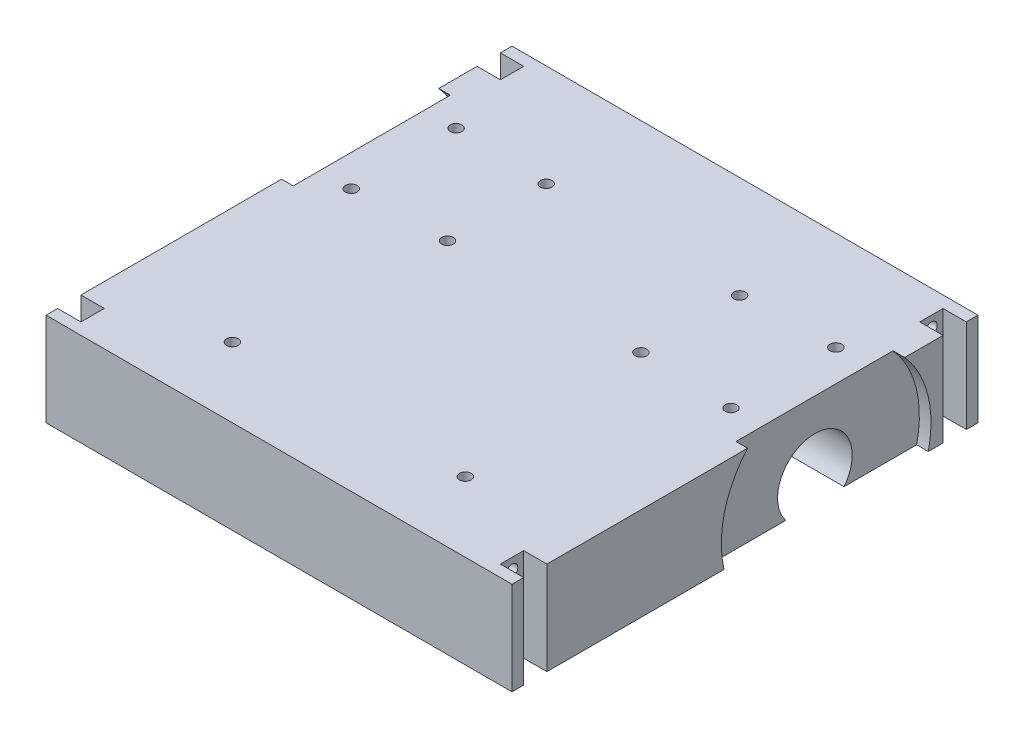
from build123d import *

# Parameters (mm, degrees)
ESQUISSE2_W             = 200
ESQUISSE2_H             = 200
BASE_DEPTH              = 40
ESQUISSE3_R             = 15
BLOC_MOTEUR_1_DEPTH     = 80
ESQUISSE4_W             = 10
ESQUISSE4_H             = 22.360679774
ACCES_MOTEUR_DEPTH      = 37
ESQUISSE6_R             = 16.01
BLOC_MOTEUR_2_DEPTH     = 37
ESQUISSE7_R             = 2.5
VIS_MOTEUR_DEPTH        = 147.969384567
ESQUISSE8_R             = 45
VIDE_ROUE_DEPTH         = 5
ESQUISSE9_W             = 10
ESQUISSE9_H             = 40
VIDE_GUIDAGE_TIGE_DEPTH = 10
ESQUISSE10_R            = 2.5
TROU_VIS_DEPTH          = 100
ESQUISSE11_R            = 2.5
VIDE_PATIN_DEPTH        = 147.969384567


with BuildPart() as part:
    # Esquisse2 → BASE (new body)
    with BuildSketch(Plane(origin=(0, 0, 0), x_dir=(1, 0, 0), z_dir=(0, 1, 0))):
        Rectangle(ESQUISSE2_W, ESQUISSE2_H)
    extrude(amount=BASE_DEPTH)

    # Esquisse3 → BLOC MOTEUR 1. (cut)
    with BuildSketch(Plane(origin=(100, 0, 0), x_dir=(0, 0, -1), z_dir=(1, 0, 0))):
        with Locations((35, 10)):
            Circle(ESQUISSE3_R)
    bloc_moteur_1 = extrude(amount=-BLOC_MOTEUR_1_DEPTH, mode=Mode.SUBTRACT)

    # Esquisse4 → ACCES MOTEUR (cut)
    with BuildSketch(Plane.XZ):
        with Locations((25, -35)):
            Rectangle(ESQUISSE4_W, ESQUISSE4_H)
    acces_moteur = extrude(amount=-ACCES_MOTEUR_DEPTH, mode=Mode.SUBTRACT)

    # Esquisse6 → BLOC MOTEUR 2 (cut)
    with BuildSketch(Plane(origin=(100, 0, 0), x_dir=(0, 0, -1), z_dir=(1, 0, 0))):
        with Locations((35, 10)):
            Circle(ESQUISSE6_R)
    bloc_moteur_2 = extrude(amount=-BLOC_MOTEUR_2_DEPTH, mode=Mode.SUBTRACT)

    # SYM BLOC MOTEUR: BLOC MOTEUR 1., ACCES MOTEUR, BLOC MOTEUR 2 across plane
    add(bloc_moteur_1.mirror(Plane(origin=(0, 0, 0), x_dir=(0, 0, 1), z_dir=(1, 0, 0))), mode=Mode.SUBTRACT)
    add(acces_moteur.mirror(Plane(origin=(0, 0, 0), x_dir=(0, 0, 1), z_dir=(1, 0, 0))), mode=Mode.SUBTRACT)
    add(bloc_moteur_2.mirror(Plane(origin=(0, 0, 0), x_dir=(0, 0, 1), z_dir=(1, 0, 0))), mode=Mode.SUBTRACT)

    # Esquisse7 → VIS MOTEUR (cut, through all)
    with BuildSketch(Plane.XZ):
        with Locations(Location((-81.5, -12.497196314, 0), (0, 0, 270))):
            Circle(ESQUISSE7_R)
        with Locations(Location((-41.5, -13.819660113, 0), (0, 0, 270))):
            Circle(ESQUISSE7_R)
        with Locations(Location((-41.5, -56.180339887, 0), (0, 0, 270))):
            Circle(ESQUISSE7_R)
        with Locations(Location((-81.5, -57.502803686, 0), (0, 0, 270))):
            Circle(ESQUISSE7_R)
    vis_moteur = extrude(amount=-VIS_MOTEUR_DEPTH, mode=Mode.SUBTRACT)

    # SYM VIS: VIS MOTEUR across plane
    add(vis_moteur.mirror(Plane(origin=(0, 0, 0), x_dir=(0, 0, 1), z_dir=(1, 0, 0))), mode=Mode.SUBTRACT)

    # Esquisse8 → VIDE ROUE (cut)
    with BuildSketch(Plane(origin=(100, 0, 0), x_dir=(0, 0, -1), z_dir=(1, 0, 0))):
        with Locations((34.831239624, 10.203988641)):
            Circle(ESQUISSE8_R)
    vide_roue = extrude(amount=-VIDE_ROUE_DEPTH, mode=Mode.SUBTRACT)

    # Esquisse9 → VIDE GUIDAGE TIGE (cut)
    with BuildSketch(Plane(origin=(100, 0, 0), x_dir=(0, 0, -1), z_dir=(1, 0, 0))):
        with Locations((90, 20)):
            Rectangle(ESQUISSE9_W, ESQUISSE9_H)
        with Locations((-90, 20)):
            Rectangle(ESQUISSE9_W, ESQUISSE9_H)
    vide_guidage_tige = extrude(amount=-VIDE_GUIDAGE_TIGE_DEPTH, mode=Mode.SUBTRACT)

    # Esquisse10 → TROU VIS (cut)
    with BuildSketch(Plane(origin=(90, 0, 0), x_dir=(0, 0, -1), z_dir=(1, 0, 0))):
        with Locations((-90, 35)):
            Circle(ESQUISSE10_R)
        with Locations((-90, 25)):
            Circle(ESQUISSE10_R)
        with Locations(Location((90, 25, 0), (0, 0, 180))):
            Circle(ESQUISSE10_R)
        with Locations(Location((90, 35, 0), (0, 0, 180))):
            Circle(ESQUISSE10_R)
        with Locations((-90, 15)):
            Circle(ESQUISSE10_R)
        with Locations(Location((90, 15, 0), (0, 0, 180))):
            Circle(ESQUISSE10_R)
    trou_vis = extrude(amount=-TROU_VIS_DEPTH, mode=Mode.SUBTRACT)

    # SYM - ROUE - TIGE: VIDE ROUE, VIDE GUIDAGE TIGE, TROU VIS across plane
    add(vide_roue.mirror(Plane(origin=(0, 0, 0), x_dir=(0, 0, 1), z_dir=(1, 0, 0))), mode=Mode.SUBTRACT)
    add(vide_guidage_tige.mirror(Plane(origin=(0, 0, 0), x_dir=(0, 0, 1), z_dir=(1, 0, 0))), mode=Mode.SUBTRACT)
    add(trou_vis.mirror(Plane(origin=(0, 0, 0), x_dir=(0, 0, 1), z_dir=(1, 0, 0))), mode=Mode.SUBTRACT)

    # Esquisse11 → VIDE PATIN (cut, through all)
    with BuildSketch(Plane.XZ):
        with Locations(Location((-50, 70, 0), (0, 0, 270))):
            Circle(ESQUISSE11_R)
        with Locations(Location((50, 70, 0), (0, 0, 90))):
            Circle(ESQUISSE11_R)
    extrude(amount=-VIDE_PATIN_DEPTH, mode=Mode.SUBTRACT)


solid = part.part
